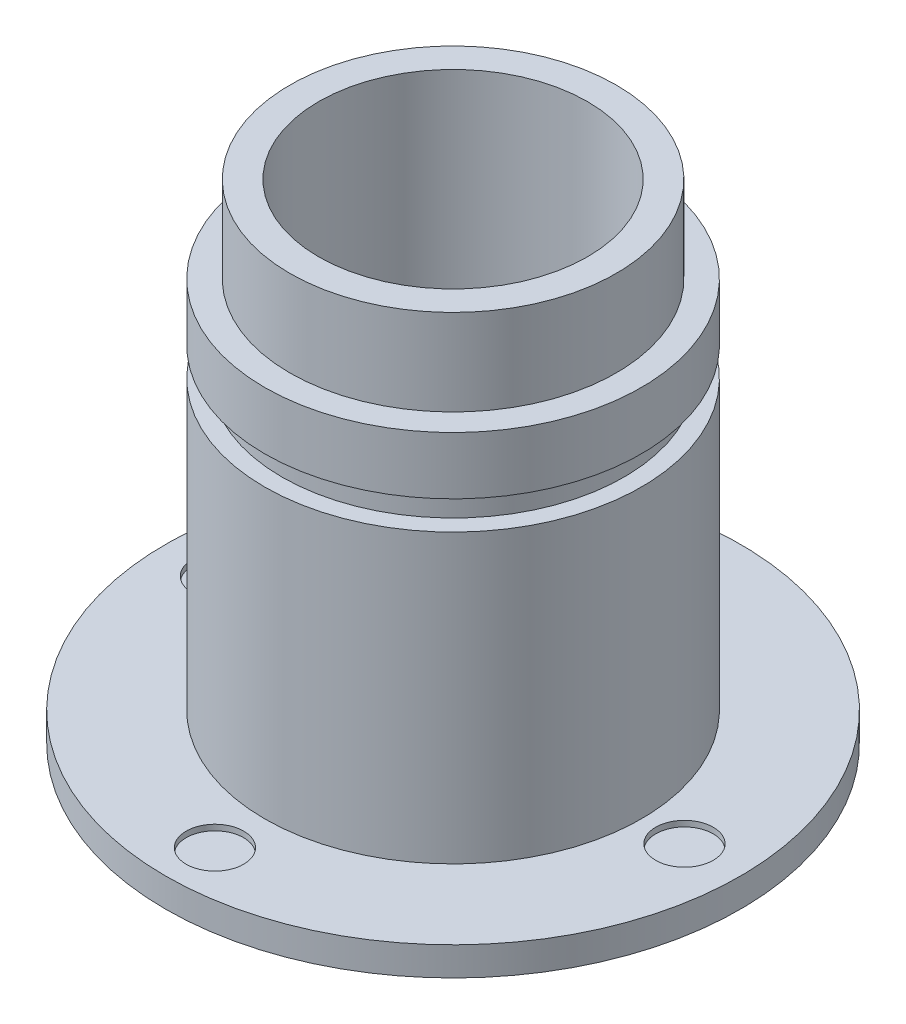
from build123d import *

# Parameters (mm, degrees)
SKETCH2_R          = 12.7
CUT_EXTRUDE1_DEPTH = 67.514107143


with BuildPart() as part:
    # Sketch1 → Revolve1 (revolve)
    with BuildSketch(Plane.XY, mode=Mode.PRIVATE) as revolve1_sk:
        Polygon((0, -77.674107143), (-127, -77.674107143), (-127, -64.974107143), (-83.230357143, -64.974107143), (-83.230357143, -14.174107143), (-83.230357143, 62.025892857), (-75.610357143, 62.025892857), (-75.610357143, 74.725892857), (-83.230357143, 74.725892857), (-83.230357143, 100.125892857), (-72.117857143, 100.125892857), (-72.117857143, 138.225892857), (-59.417857143, 138.225892857), (-59.417857143, -64.974107143), (0, -64.974107143), align=None)
    revolve(revolve1_sk.sketch.rotate(Axis((0, 71.324107143, 0), (0, -1, 0)), 270), axis=Axis((0, 71.324107143, 0), (0, -1, 0)))

    # Sketch2 → Cut-Extrude1 (cut)
    with BuildSketch(Plane(origin=(0, 0, 0), x_dir=(1, 0, 0), z_dir=(0, 1, 0))):
        with Locations(Location((-102.608331848, 0, 0), (0, 0, 270))):
            Circle(SKETCH2_R)
        with Locations(Location((0, -105.234824984, 0), (0, 0, 270))):
            Circle(SKETCH2_R)
        with Locations(Location((102.258132763, 0, 0), (0, 0, 270))):
            Circle(SKETCH2_R)
        with Locations(Location((0, 99.281440542, 0), (0, 0, 270))):
            Circle(SKETCH2_R)
    extrude(amount=-CUT_EXTRUDE1_DEPTH, mode=Mode.SUBTRACT)


solid = part.part
